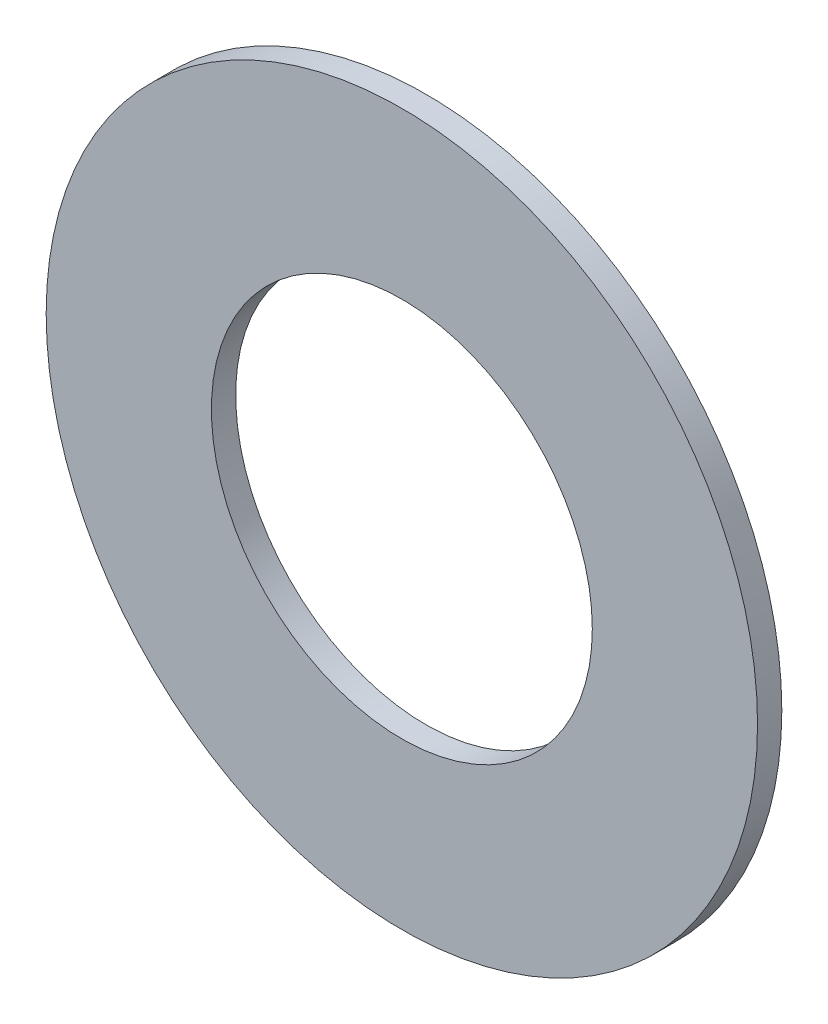
from build123d import *

# Parameters (mm, degrees)
BOSS_EXTRUDE1_DEPTH      = 0.4064
BOSS_EXTRUDE1_DEPTH_BACK = 0.4064
SKETCH3_R                = 11.90625
SKETCH3_R_2              = 6.3754


with BuildPart() as part:
    # Sketch3 → Boss-Extrude1 (new, two sides: drawn at the far end of the back side and taken through both)
    with BuildSketch(Plane.XY.offset(-BOSS_EXTRUDE1_DEPTH_BACK)):
        Circle(SKETCH3_R)
        Circle(SKETCH3_R_2, mode=Mode.SUBTRACT)
    extrude(amount=BOSS_EXTRUDE1_DEPTH + BOSS_EXTRUDE1_DEPTH_BACK)


solid = part.part
